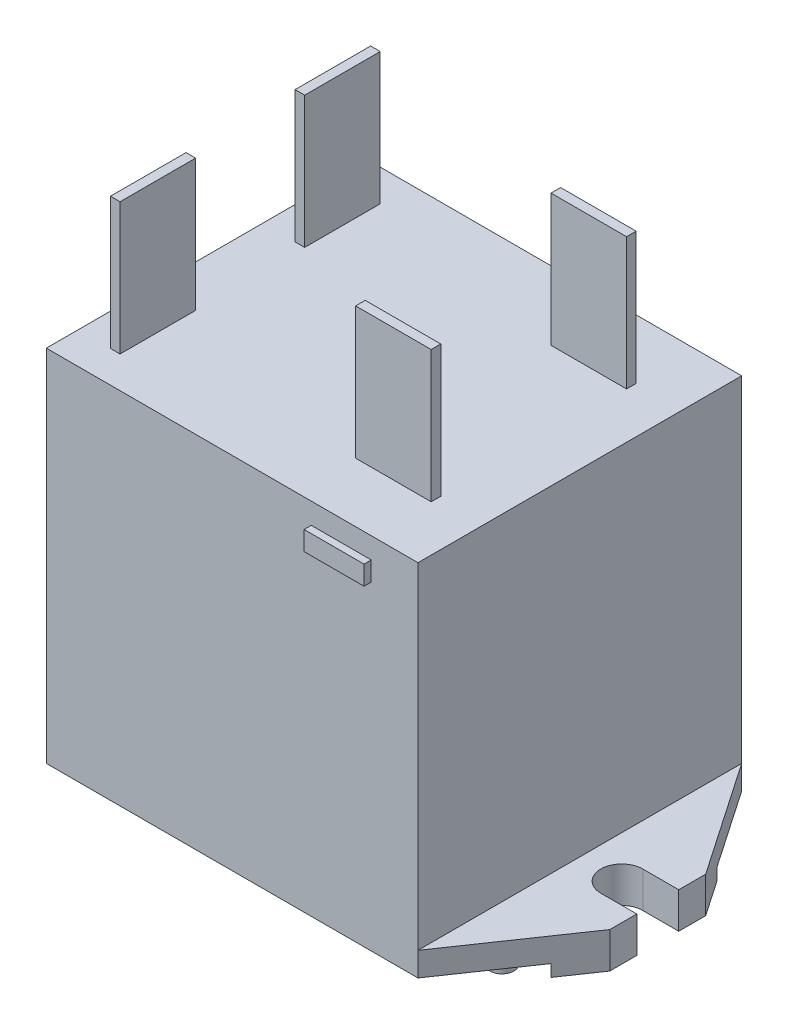
from build123d import *

# Parameters (mm, degrees)
EXTRUDE_364_DEPTH   = 3
CUT_EXTRUDE_1_DEPTH = 44.269504273
CUT_EXTRUDE_2_DEPTH = 1
SKETCH_4_W          = 31
SKETCH_4_H          = 27
EXTRUDE_1_DEPTH     = 28
SKETCH_5_W          = 0.8
SKETCH_5_H          = 6.3
SKETCH_5_W_2        = 6.3
SKETCH_5_H_2        = 0.8
EXTRUDE_2_DEPTH     = 11
SKETCH_6_W          = 5
SKETCH_6_H          = 1.6
EXTRUDE_3_DEPTH     = 0.6
SKETCH_7_W          = 5
SKETCH_7_H          = 1.6
EXTRUDE_4_DEPTH     = 0.6
SKETCH_8_R          = 1
EXTRUDE_5_DEPTH     = 1


with BuildPart() as part:
    # ｽｹｯﾁ1 → Extrude 364 (new body)
    with BuildSketch(Plane(origin=(0, 0, 0), x_dir=(1, 0, 0), z_dir=(0, 1, 0))):
        Polygon((-3, 4), (-3, -4), (3.5, -13.5), (34.5, -13.5), (41, -4), (41, 4), (34.5, 13.5), (3.5, 13.5), align=None)
    extrude(amount=EXTRUDE_364_DEPTH)

    # ｽｹｯﾁ2 → ｶｯﾄ - 押し出し1 (cut, through all)
    with BuildSketch(Plane(origin=(0, 3, 0), x_dir=(-1, 0, 0), z_dir=(0, 1, 0))):
        with BuildLine():
            Line((-41, 1.75), (-38, 1.75))
            ThreePointArc((-38, 1.75), (-36.25, 0), (-38, -1.75))
            Line((-38, -1.75), (-41, -1.75))
            Line((-41, -1.75), (-41, 1.75))
        make_face()
        with BuildLine():
            Line((3, 1.75), (0, 1.75))
            ThreePointArc((0, 1.75), (-1.75, 0), (0, -1.75))
            Line((0, -1.75), (3, -1.75))
            Line((3, -1.75), (3, 1.75))
        make_face()
    extrude(amount=-CUT_EXTRUDE_1_DEPTH, mode=Mode.SUBTRACT)

    # ｽｹｯﾁ3 → ｶｯﾄ - 押し出し2 (cut)
    with BuildSketch(Plane.XZ):
        Polygon((39, 3.75), (39, 6.923076923), (34.5, 13.5), (3.5, 13.5), (-1, 6.923076923), (-1, 3.75), (-0.747712751, 3.75), (4.554918828, 11.5), (33.445081172, 11.5), (38.747712751, 3.75), align=None)
        with BuildLine():
            Line((38, 3.75), (38.747712751, 3.75))
            Line((38.747712751, 3.75), (33.445081172, 11.5))
            Line((33.445081172, 11.5), (4.554918828, 11.5))
            Line((4.554918828, 11.5), (-0.747712751, 3.75))
            Line((-0.747712751, 3.75), (0, 3.75))
            ThreePointArc((0, 3.75), (3.75, 0), (0, -3.75))
            Line((0, -3.75), (-0.747712751, -3.75))
            Line((-0.747712751, -3.75), (4.554918828, -11.5))
            Line((4.554918828, -11.5), (33.445081172, -11.5))
            Line((33.445081172, -11.5), (38.747712751, -3.75))
            Line((38.747712751, -3.75), (38, -3.75))
            ThreePointArc((38, -3.75), (34.25, 0), (38, 3.75))
        make_face()
        Polygon((39, -3.75), (38.747712751, -3.75), (33.445081172, -11.5), (4.554918828, -11.5), (-0.747712751, -3.75), (-1, -3.75), (-1, -6.923076923), (3.5, -13.5), (34.5, -13.5), (39, -6.923076923), align=None)
    extrude(amount=-CUT_EXTRUDE_2_DEPTH, mode=Mode.SUBTRACT)

    # ｽｹｯﾁ4 → ﾎﾞｽ - 押し出し1 (add)
    with BuildSketch(Plane(origin=(0, 3, 0), x_dir=(-1, 0, 0), z_dir=(0, 1, 0))):
        with Locations((-19, 0)):
            Rectangle(SKETCH_4_W, SKETCH_4_H)
    extrude(amount=EXTRUDE_1_DEPTH)

    # ｽｹｯﾁ5 → ﾎﾞｽ - 押し出し2 (add)
    with BuildSketch(Plane(origin=(0, 31, 0), x_dir=(-1, 0, 0), z_dir=(0, 1, 0))):
        with Locations((-6.6, -7.7)):
            Rectangle(SKETCH_5_W, SKETCH_5_H)
        with Locations((-6.6, 7.7)):
            Rectangle(SKETCH_5_W, SKETCH_5_H)
        with Locations((-27.5, -8.15)):
            Rectangle(SKETCH_5_W_2, SKETCH_5_H_2)
        with Locations((-27.5, 8.15)):
            Rectangle(SKETCH_5_W_2, SKETCH_5_H_2)
    extrude(amount=EXTRUDE_2_DEPTH)

    # ｽｹｯﾁ6 → ﾎﾞｽ - 押し出し3 (add)
    with BuildSketch(Plane.XY.offset(13.5)):
        with Locations((28.1, 28.45)):
            Rectangle(SKETCH_6_W, SKETCH_6_H)
    extrude(amount=EXTRUDE_3_DEPTH)

    # ｽｹｯﾁ7 → ﾎﾞｽ - 押し出し4 (add)
    with BuildSketch(Plane(origin=(0, 0, -13.5), x_dir=(-1, 0, 0), z_dir=(0, 0, -1))):
        with Locations((-9.9, 28.45)):
            Rectangle(SKETCH_7_W, SKETCH_7_H)
    extrude(amount=EXTRUDE_4_DEPTH)

    # ｽｹｯﾁ8 → ﾎﾞｽ - 押し出し5 (add)
    with BuildSketch(Plane.XZ.offset(-1)):
        with Locations(Location((19, 11.5, 0), (0, 0, 270))):
            Circle(SKETCH_8_R)
        with Locations(Location((19, -11.5, 0), (0, 0, 270))):
            Circle(SKETCH_8_R)
        with Locations(Location((36, 8, 0), (0, 0, 270))):
            Circle(SKETCH_8_R)
        with Locations(Location((36, -8, 0), (0, 0, 270))):
            Circle(SKETCH_8_R)
        with Locations(Location((2, 8, 0), (0, 0, 270))):
            Circle(SKETCH_8_R)
        with Locations(Location((2, -8, 0), (0, 0, 270))):
            Circle(SKETCH_8_R)
    extrude(amount=EXTRUDE_5_DEPTH)


solid = part.part
